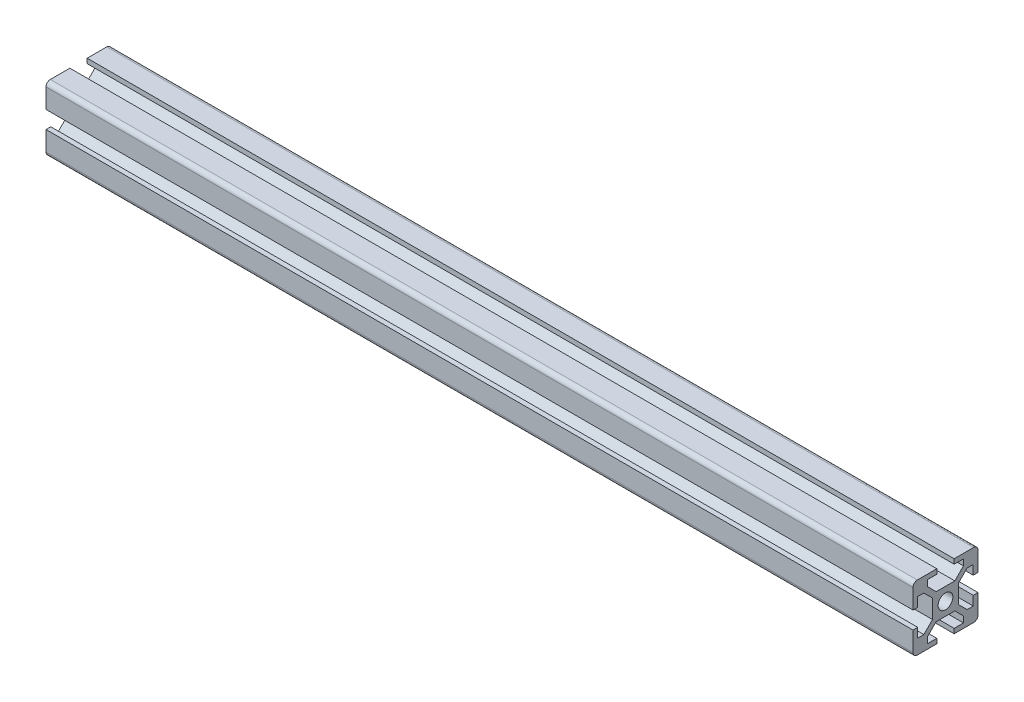
from build123d import *

# Parameters (mm, degrees)
SKETCH17_R                       = 3.4
ALUMINIUM_EXTRUSION_3030_1_DEPTH = 400


with BuildPart() as part:
    # Sketch17 → Aluminium extrusion 3030(1) (new body)
    with BuildSketch(Plane(origin=(0, 0, 0), x_dir=(0, 0, -1), z_dir=(1, 0, 0))):
        with BuildLine():
            Line((0, 6), (-4.302943725, 6))
            Line((-4.302943725, 6), (-8.3, 9.997056275))
            Line((-8.3, 9.997056275), (-8.3, 12.8))
            Line((-8.3, 12.8), (-4, 12.8))
            Line((-4, 12.8), (-4, 15))
            Line((-4, 15), (-13, 15))
            ThreePointArc((-13, 15), (-14.414213562, 14.414213562), (-15, 13))
            Line((-15, 13), (-15, 4))
            Line((-15, 4), (-12.8, 4))
            Line((-12.8, 4), (-12.8, 8.3))
            Line((-12.8, 8.3), (-9.997056275, 8.3))
            Line((-9.997056275, 8.3), (-6, 4.302943725))
            Line((-6, 4.302943725), (-6, 0))
            Line((-6, 0), (-6, -4.302943725))
            Line((-6, -4.302943725), (-9.997056275, -8.3))
            Line((-9.997056275, -8.3), (-12.8, -8.3))
            Line((-12.8, -8.3), (-12.8, -4))
            Line((-12.8, -4), (-15, -4))
            Line((-15, -4), (-15, -13))
            ThreePointArc((-15, -13), (-14.414213562, -14.414213562), (-13, -15))
            Line((-13, -15), (-4, -15))
            Line((-4, -15), (-4, -12.8))
            Line((-4, -12.8), (-8.3, -12.8))
            Line((-8.3, -12.8), (-8.3, -9.997056275))
            Line((-8.3, -9.997056275), (-4.302943725, -6))
            Line((-4.302943725, -6), (0, -6))
            Line((0, -6), (4.302943725, -6))
            Line((4.302943725, -6), (8.3, -9.997056275))
            Line((8.3, -9.997056275), (8.3, -12.8))
            Line((8.3, -12.8), (4, -12.8))
            Line((4, -12.8), (4, -15))
            Line((4, -15), (13, -15))
            ThreePointArc((13, -15), (14.414213562, -14.414213562), (15, -13))
            Line((15, -13), (15, -4))
            Line((15, -4), (12.8, -4))
            Line((12.8, -4), (12.8, -8.3))
            Line((12.8, -8.3), (9.997056275, -8.3))
            Line((9.997056275, -8.3), (6, -4.302943725))
            Line((6, -4.302943725), (6, 0))
            Line((6, 0), (6, 4.302943725))
            Line((6, 4.302943725), (9.997056275, 8.3))
            Line((9.997056275, 8.3), (12.8, 8.3))
            Line((12.8, 8.3), (12.8, 4))
            Line((12.8, 4), (15, 4))
            Line((15, 4), (15, 13))
            ThreePointArc((15, 13), (14.414213562, 14.414213562), (13, 15))
            Line((13, 15), (4, 15))
            Line((4, 15), (4, 12.8))
            Line((4, 12.8), (8.3, 12.8))
            Line((8.3, 12.8), (8.3, 9.997056275))
            Line((8.3, 9.997056275), (4.302943725, 6))
            Line((4.302943725, 6), (0, 6))
        make_face()
        Circle(SKETCH17_R, mode=Mode.SUBTRACT)
    extrude(amount=ALUMINIUM_EXTRUSION_3030_1_DEPTH)


solid = part.part
